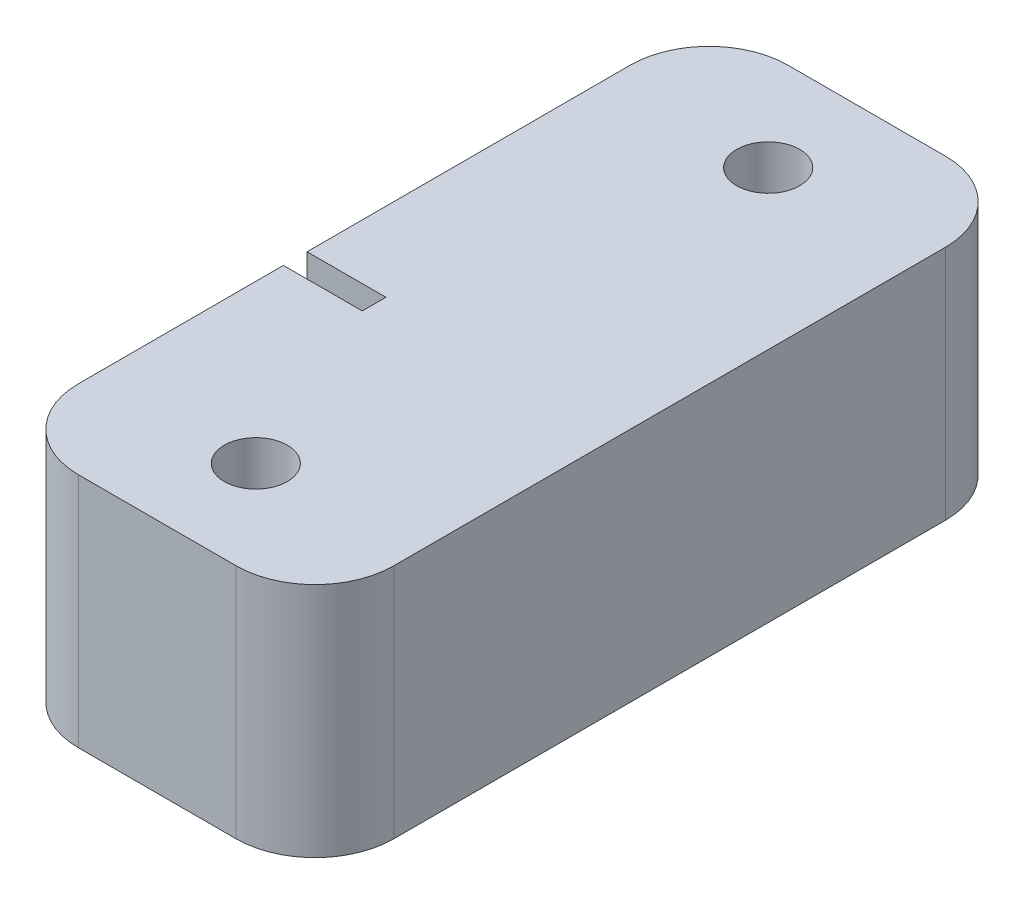
from build123d import *

# Parameters (mm, degrees)
SKETCH2_W           = 40
SKETCH2_H           = 90
BOSS_EXTRUDE1_DEPTH = 30
SKETCH3_R           = 4
CUT_EXTRUDE1_DEPTH  = 20
SKETCH4_R           = 4
SKETCH4_R_2         = 2.5
SKETCH4_W           = 3
SKETCH4_H           = 12
CUT_EXTRUDE2_DEPTH  = 10
FILLET1_R           = 10


with BuildPart() as part:
    # Sketch2 → Boss-Extrude1 (new body)
    with BuildSketch(Plane(origin=(0, 0, 0), x_dir=(1, 0, 0), z_dir=(0, 1, 0))):
        with Locations((-3.52238806, 4.76119403)):
            Rectangle(SKETCH2_W, SKETCH2_H)
    extrude(amount=BOSS_EXTRUDE1_DEPTH)

    # Sketch3 → Cut-Extrude1 (cut)
    with BuildSketch(Plane(origin=(0, 30, 0), x_dir=(1, 0, 0), z_dir=(0, 1, 0))):
        with Locations(Location((-3.52238806, 37.26119403, 0), (0, 0, 270))):
            Circle(SKETCH3_R)
        with Locations(Location((-3.52238806, -27.73880597, 0), (0, 0, 270))):
            Circle(SKETCH3_R)
    extrude(amount=-CUT_EXTRUDE1_DEPTH, mode=Mode.SUBTRACT)

    # Sketch4 → Cut-Extrude2 (cut)
    # profile 1 of 2: a face of its own
    with BuildSketch(Plane.ZY.offset(23.52238806)):
        with Locations((2.73880597, 15)):
            Circle(SKETCH4_R)
        with Locations((2.73880597, 15)):
            Circle(SKETCH4_R_2, mode=Mode.SUBTRACT)
    # profile 2 of 2: a face of its own
    with BuildSketch(Plane.ZY.offset(23.52238806)):
        with Locations((2.73880597, 24)):
            Rectangle(SKETCH4_W, SKETCH4_H)
    extrude(amount=-CUT_EXTRUDE2_DEPTH, mode=Mode.SUBTRACT)

    # Fillet1
    fillet1_edges = [part.edges().sort_by_distance(p)[0] for p in [
        (-23.52238806, 15, -49.76119403),
        (16.47761194, 15, -49.76119403),
        (16.47761194, 15, 40.23880597),
        (-23.52238806, 15, 40.23880597),
    ]]
    fillet(fillet1_edges, radius=FILLET1_R)


solid = part.part
